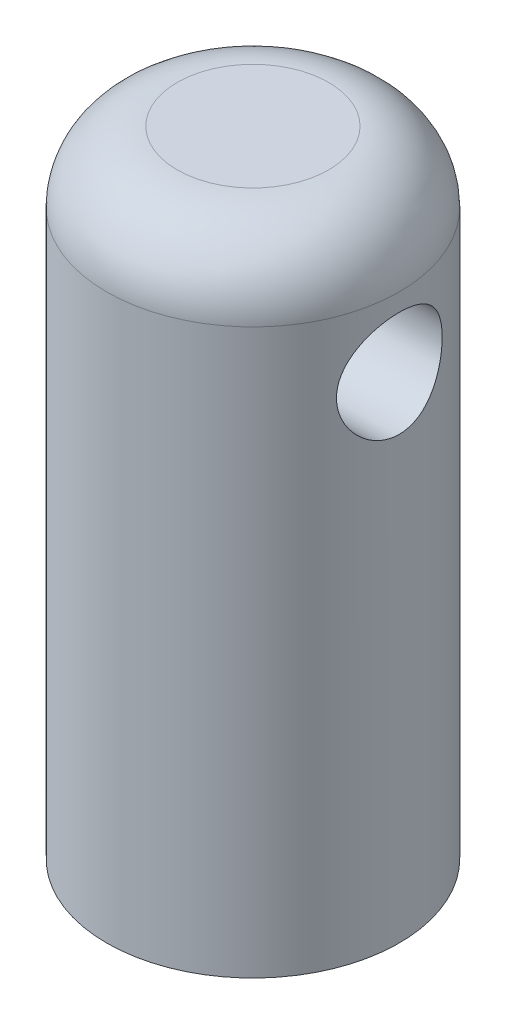
from build123d import *

# Parameters (mm, degrees)
SKETCH2_R               = 4.15
BOSS_EXTRUDE1_DEPTH     = 18
SKETCH3_R               = 1.75
CUT_EXTRUDE1_DEPTH      = 10
CUT_EXTRUDE2_DEPTH      = 19.932643767
CUT_EXTRUDE2_DEPTH_BACK = 19.932643767
SKETCH4_R               = 1.5
FILLET1_R               = 2


with BuildPart() as part:
    # Sketch2 → Boss-Extrude1 (new body)
    with BuildSketch(Plane(origin=(0, 0, 0), x_dir=(1, 0, 0), z_dir=(0, 1, 0))):
        with Locations(Location((0, 0, 0), (0, 0, 270))):
            Circle(SKETCH2_R)
    extrude(amount=BOSS_EXTRUDE1_DEPTH)

    # Sketch3 → Cut-Extrude1 (cut)
    with BuildSketch(Plane.XZ):
        with Locations(Location((0, 0, 0), (0, 0, 270))):
            Circle(SKETCH3_R)
    extrude(amount=-CUT_EXTRUDE1_DEPTH, mode=Mode.SUBTRACT)

    # Sketch4 → Cut-Extrude2 (cut, two sides: drawn at the far end of the back side and taken through both)
    with BuildSketch(Plane(origin=(0, 0, 0), x_dir=(0, 0, -1), z_dir=(1, 0, 0)).offset(-CUT_EXTRUDE2_DEPTH_BACK)):
        with Locations((0, 14)):
            Circle(SKETCH4_R)
    extrude(amount=CUT_EXTRUDE2_DEPTH + CUT_EXTRUDE2_DEPTH_BACK, mode=Mode.SUBTRACT)

    # Fillet1
    fillet1_edges = [part.edges().sort_by_distance(p)[0] for p in [
        (0, 18, -4.15),
    ]]
    fillet(fillet1_edges, radius=FILLET1_R)


solid = part.part
